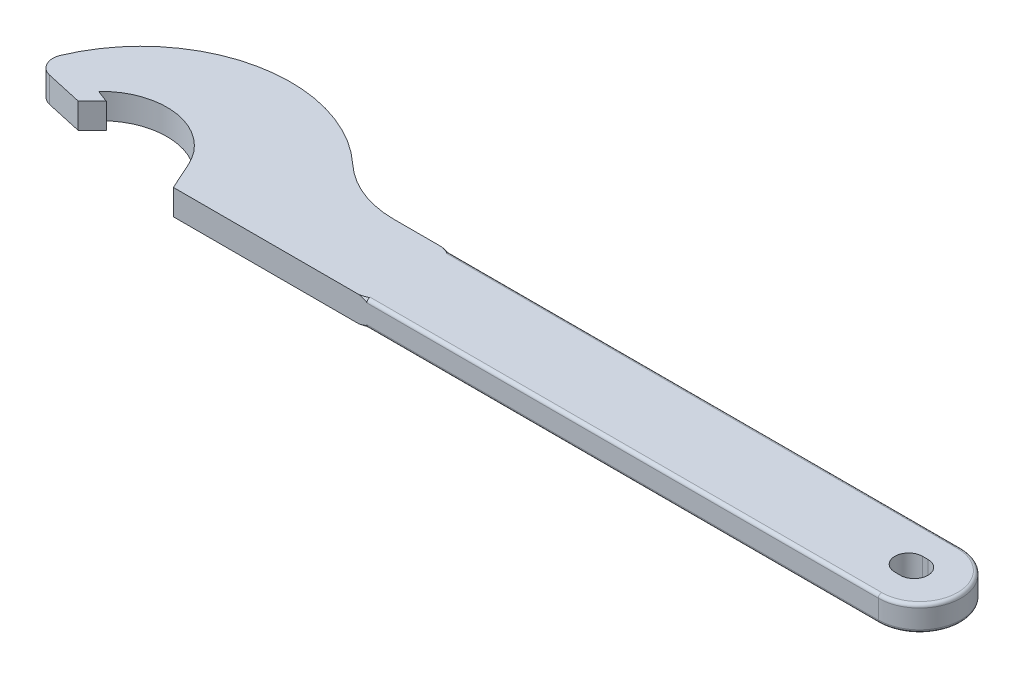
from build123d import *

# Parameters (mm, degrees)
F1_OUTLINE_DEPTH            = 1.524
F2_SLOT_DEPTH               = 58.881120617
F2_SLOT_DEPTH_BACK          = 58.881120617
F3A_HANDLEROUNDS_DEPTH      = 50.053367
F3A_HANDLEROUNDS_DEPTH_BACK = 11.2136936
F3B_ENDROUND_ANGLE          = 180
F4_RUNOUT_TOP_POS_ANGLE     = 90
F4_RUNOUT_BOT_POS_ANGLE     = 90
F4_RUNOUT_TOP_NEG_ANGLE     = 90
F4_RUNOUT_BOT_NEG_ANGLE     = 90


with BuildPart() as part:
    # SK_F1_Outline → F1_Outline (new, symmetric)
    with BuildSketch(Plane(origin=(0, 0, 0), x_dir=(1, 0, 0), z_dir=(0, 1, 0))):
        with BuildLine():
            Line((-34.3917778, 0), (50.053367, 0))
            ThreePointArc((50.053367, 0), (55.0037, 4.950333), (50.053367, 9.900666))
            Line((50.053367, 9.900666), (-17.8811936, 9.900666))
            ThreePointArc((-17.8811936, 9.900666), (-22.254213469, 10.732825234), (-26.01595, 13.1129786))
            ThreePointArc((-26.01595, 13.1129786), (-42.046618803, 17.559873613), (-54.849649, 6.9372734))
            ThreePointArc((-54.849649, 6.9372734), (-54.781279257, 5.257869905), (-53.4488136, 4.2333672))
            Line((-53.4488136, 4.2333672), (-49.0586522, 3.26009))
            Line((-49.0586522, 3.26009), (-47.3517722, 4.920488))
            Line((-47.3517722, 4.920488), (-48.8359196, 5.483987))
            ThreePointArc((-48.8359196, 5.483987), (-41.756588445, 7.823426138), (-35.8603296, 3.26009))
            Line((-35.8603296, 3.26009), (-34.3917778, 0))
        make_face()
    extrude(amount=F1_OUTLINE_DEPTH, both=True)

    # SK_F2_Slot → F2_Slot (cut, two sides: drawn at the far end of the back side and taken through both)
    with BuildSketch(Plane(origin=(0, 0, 0), x_dir=(1, 0, 0), z_dir=(0, 1, 0)).offset(-F2_SLOT_DEPTH_BACK)):
        with BuildLine():
            Line((48.7354118, 3.300222), (49.3954308, 3.300222))
            ThreePointArc((49.3954308, 3.300222), (51.0455418, 4.950333), (49.3954308, 6.600444))
            Line((49.3954308, 6.600444), (48.7354118, 6.600444))
            ThreePointArc((48.7354118, 6.600444), (47.0853008, 4.950333), (48.7354118, 3.300222))
        make_face()
    extrude(amount=F2_SLOT_DEPTH + F2_SLOT_DEPTH_BACK, mode=Mode.SUBTRACT)

    # SK_F3_StraightRounds → F3a_HandleRounds (cut, two sides: drawn at the far end of the back side and taken through both)
    with BuildSketch(Plane(origin=(0, 0, 0), x_dir=(0, 0, -1), z_dir=(1, 0, 0)).offset(-F3A_HANDLEROUNDS_DEPTH_BACK)):
        with BuildLine():
            Line((0, 1.127125), (-0.254, 1.127125))
            Line((-0.254, 1.127125), (-0.254, 1.778))
            Line((-0.254, 1.778), (0.396875, 1.778))
            Line((0.396875, 1.778), (0.396875, 1.524))
            ThreePointArc((0.396875, 1.524), (0.116241996, 1.407758004), (0, 1.127125))
        make_face()
        with BuildLine():
            Line((9.900666, 1.127125), (10.154666, 1.127125))
            Line((10.154666, 1.127125), (10.154666, 1.778))
            Line((10.154666, 1.778), (9.503791, 1.778))
            Line((9.503791, 1.778), (9.503791, 1.524))
            ThreePointArc((9.503791, 1.524), (9.784424004, 1.407758004), (9.900666, 1.127125))
        make_face()
        with BuildLine():
            Line((0, -1.127125), (-0.254, -1.127125))
            Line((-0.254, -1.127125), (-0.254, -1.778))
            Line((-0.254, -1.778), (0.396875, -1.778))
            Line((0.396875, -1.778), (0.396875, -1.524))
            ThreePointArc((0.396875, -1.524), (0.116241996, -1.407758004), (0, -1.127125))
        make_face()
        with BuildLine():
            Line((9.900666, -1.127125), (10.154666, -1.127125))
            Line((10.154666, -1.127125), (10.154666, -1.778))
            Line((10.154666, -1.778), (9.503791, -1.778))
            Line((9.503791, -1.778), (9.503791, -1.524))
            ThreePointArc((9.503791, -1.524), (9.784424004, -1.407758004), (9.900666, -1.127125))
        make_face()
    extrude(amount=F3A_HANDLEROUNDS_DEPTH + F3A_HANDLEROUNDS_DEPTH_BACK, mode=Mode.SUBTRACT)

    # SK_F3_EndRound → F3b_EndRound (revolve, symmetric, cut)
    with BuildSketch(Plane.XY.offset(-4.950333)) as f3b_endround_sk:
        with BuildLine():
            Line((55.0037, 1.127125), (55.2577, 1.127125))
            Line((55.2577, 1.127125), (55.2577, 1.778))
            Line((55.2577, 1.778), (54.606825, 1.778))
            Line((54.606825, 1.778), (54.606825, 1.524))
            ThreePointArc((54.606825, 1.524), (54.887458004, 1.407758004), (55.0037, 1.127125))
        make_face()
        with BuildLine():
            Line((55.0037, -1.127125), (55.2577, -1.127125))
            Line((55.2577, -1.127125), (55.2577, -1.778))
            Line((55.2577, -1.778), (54.606825, -1.778))
            Line((54.606825, -1.778), (54.606825, -1.524))
            ThreePointArc((54.606825, -1.524), (54.887458004, -1.407758004), (55.0037, -1.127125))
        make_face()
    revolve(axis=Axis((50.053367, -2.54, -4.950333), (0, 1, 0)), revolution_arc=F3B_ENDROUND_ANGLE / 2, mode=Mode.SUBTRACT)
    revolve(f3b_endround_sk.sketch, axis=Axis((50.053367, -2.54, -4.950333), (0, -1, 0)), revolution_arc=F3B_ENDROUND_ANGLE / 2, mode=Mode.SUBTRACT)

    # SK_F4_Runout1 → F4_Runout_Top_Pos (revolve, cut)
    with BuildSketch(Plane(origin=(0, 1.127125, 0), x_dir=(1, 0, 0), z_dir=(0, 1, 0))):
        Polygon((-11.2136936, 0), (-12.1460006, -0.164390878), (-12.1460006, -0.365125), (-11.2136936, -0.365125), align=None)
    revolve(axis=Axis((-9.9436936, 1.127125, -0.396875), (-1, 0, 0)), revolution_arc=F4_RUNOUT_TOP_POS_ANGLE, mode=Mode.SUBTRACT)

    # SK_F4_Runout2 → F4_Runout_Bot_Pos (revolve, cut)
    with BuildSketch(Plane(origin=(0, 1.127125, 0), x_dir=(1, 0, 0), z_dir=(0, 1, 0))):
        Polygon((-11.2136936, 9.900666), (-12.1460006, 10.065056878), (-12.1460006, 10.265791), (-11.2136936, 10.265791), align=None)
    revolve(axis=Axis((-9.9436936, 1.127125, -9.503791), (1, 0, 0)), revolution_arc=F4_RUNOUT_BOT_POS_ANGLE, mode=Mode.SUBTRACT)

    # SK_F4_Runout3 → F4_Runout_Top_Neg (revolve, cut)
    with BuildSketch(Plane(origin=(0, -1.127125, 0), x_dir=(1, 0, 0), z_dir=(0, 1, 0))):
        Polygon((-11.2136936, 0), (-12.1460006, -0.164390878), (-12.1460006, -0.365125), (-11.2136936, -0.365125), align=None)
    revolve(axis=Axis((-9.9436936, -1.127125, -0.396875), (1, 0, 0)), revolution_arc=F4_RUNOUT_TOP_NEG_ANGLE, mode=Mode.SUBTRACT)

    # SK_F4_Runout4 → F4_Runout_Bot_Neg (revolve, cut)
    with BuildSketch(Plane(origin=(0, -1.127125, 0), x_dir=(1, 0, 0), z_dir=(0, 1, 0))):
        Polygon((-11.2136936, 9.900666), (-12.1460006, 10.065056878), (-12.1460006, 10.265791), (-11.2136936, 10.265791), align=None)
    revolve(axis=Axis((-9.9436936, -1.127125, -9.503791), (-1, 0, 0)), revolution_arc=F4_RUNOUT_BOT_NEG_ANGLE, mode=Mode.SUBTRACT)


solid = part.part
